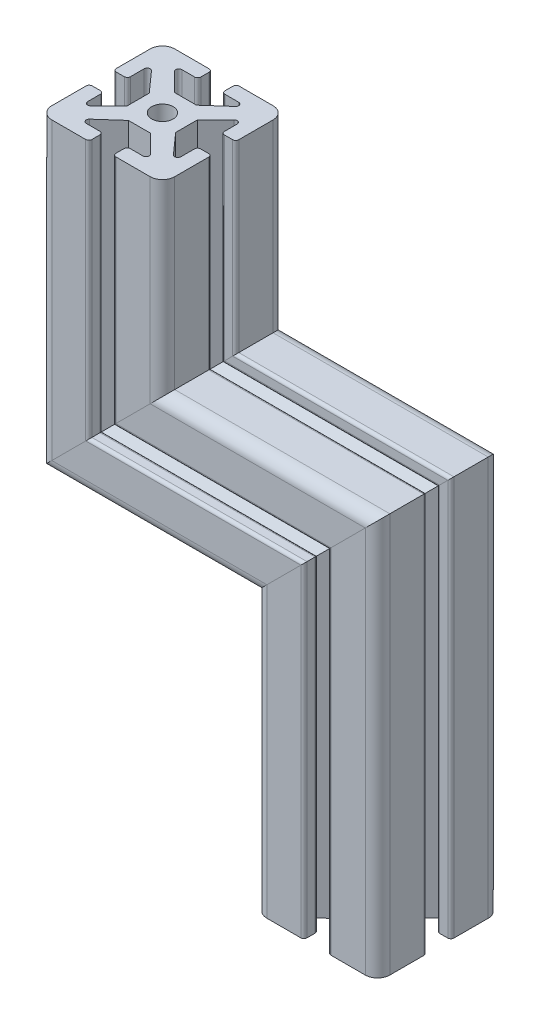
from build123d import *

# Parameters (mm, degrees)
SKETCH1_R                       = 3.492543695
F_001_40_40_EXTRUSION_1_DEPTH   = 109.284271247
SKETCH1_ON_SEGMENT_2_R          = 3.492543695
F_001_40_40_EXTRUSION_1_2_DEPTH = 128.568542495
SKETCH1_ON_SEGMENT_3_R          = 3.492543695
F_001_40_40_EXTRUSION_1_3_DEPTH = 139.284271247


with BuildPart() as part:
    # Sketch1 → 001 40-40_EXTRUSION(1) (new body)
    with BuildSketch(Plane.XZ):
        with BuildLine():
            Line((-0.51168083, 7.684671829), (3.749889801, 7.684671829))
            Line((3.749889801, 7.684671829), (9.699681879, 13.624984685))
            ThreePointArc((9.699681879, 13.624984685), (9.917171057, 14.714970099), (8.993139054, 15.332654972))
            Line((8.993139054, 15.332654972), (4.845630957, 15.332654972))
            ThreePointArc((4.845630957, 15.332654972), (4.138524175, 15.625548191), (3.845630957, 16.332654972))
            Line((3.845630957, 16.332654972), (3.845630957, 19))
            ThreePointArc((3.845630957, 19), (4.138524175, 19.707106781), (4.845630957, 20))
            Line((4.845630957, 20), (16, 20))
            ThreePointArc((16, 20), (18.828427125, 18.828427125), (20, 16))
            Line((20, 16), (20, 4.961087436))
            ThreePointArc((20, 4.961087436), (19.707106781, 4.253980655), (19, 3.961087436))
            Line((19, 3.961087436), (16.388269628, 3.961087436))
            ThreePointArc((16.388269628, 3.961087436), (15.681162846, 4.253980655), (15.388269628, 4.961087436))
            Line((15.388269628, 4.961087436), (15.388269628, 9.408620307))
            ThreePointArc((15.388269628, 9.408620307), (14.744223919, 10.343123673), (13.641676542, 10.073901274))
            Line((13.641676542, 10.073901274), (7.684671829, 3.388818206))
            Line((7.684671829, 3.388818206), (7.684671829, 0.51168083))
            Line((7.684671829, 0.51168083), (7.684671829, -3.749889801))
            Line((7.684671829, -3.749889801), (13.624984685, -9.699681879))
            ThreePointArc((13.624984685, -9.699681879), (14.714970099, -9.917171057), (15.332654972, -8.993139054))
            Line((15.332654972, -8.993139054), (15.332654972, -4.845630957))
            ThreePointArc((15.332654972, -4.845630957), (15.625548191, -4.138524175), (16.332654972, -3.845630957))
            Line((16.332654972, -3.845630957), (19, -3.845630957))
            ThreePointArc((19, -3.845630957), (19.707106781, -4.138524175), (20, -4.845630957))
            Line((20, -4.845630957), (20, -16))
            ThreePointArc((20, -16), (18.828427125, -18.828427125), (16, -20))
            Line((16, -20), (4.961087436, -20))
            ThreePointArc((4.961087436, -20), (4.253980655, -19.707106781), (3.961087436, -19))
            Line((3.961087436, -19), (3.961087436, -16.388269628))
            ThreePointArc((3.961087436, -16.388269628), (4.253980655, -15.681162846), (4.961087436, -15.388269628))
            Line((4.961087436, -15.388269628), (9.408620307, -15.388269628))
            ThreePointArc((9.408620307, -15.388269628), (10.343123673, -14.744223919), (10.073901274, -13.641676542))
            Line((10.073901274, -13.641676542), (3.388818206, -7.684671829))
            Line((3.388818206, -7.684671829), (0.51168083, -7.684671829))
            Line((0.51168083, -7.684671829), (-3.749889801, -7.684671829))
            Line((-3.749889801, -7.684671829), (-9.699681879, -13.624984685))
            ThreePointArc((-9.699681879, -13.624984685), (-9.917171057, -14.714970099), (-8.993139054, -15.332654972))
            Line((-8.993139054, -15.332654972), (-4.845630957, -15.332654972))
            ThreePointArc((-4.845630957, -15.332654972), (-4.138524175, -15.625548191), (-3.845630957, -16.332654972))
            Line((-3.845630957, -16.332654972), (-3.845630957, -19))
            ThreePointArc((-3.845630957, -19), (-4.138524175, -19.707106781), (-4.845630957, -20))
            Line((-4.845630957, -20), (-16, -20))
            ThreePointArc((-16, -20), (-18.828427125, -18.828427125), (-20, -16))
            Line((-20, -16), (-20, -4.961087436))
            ThreePointArc((-20, -4.961087436), (-19.707106781, -4.253980655), (-19, -3.961087436))
            Line((-19, -3.961087436), (-16.388269628, -3.961087436))
            ThreePointArc((-16.388269628, -3.961087436), (-15.681162846, -4.253980655), (-15.388269628, -4.961087436))
            Line((-15.388269628, -4.961087436), (-15.388269628, -9.408620307))
            ThreePointArc((-15.388269628, -9.408620307), (-14.744223919, -10.343123673), (-13.641676542, -10.073901274))
            Line((-13.641676542, -10.073901274), (-7.684671829, -3.388818206))
            Line((-7.684671829, -3.388818206), (-7.684671829, -0.51168083))
            Line((-7.684671829, -0.51168083), (-7.684671829, 3.749889801))
            Line((-7.684671829, 3.749889801), (-13.624984685, 9.699681879))
            ThreePointArc((-13.624984685, 9.699681879), (-14.714970099, 9.917171057), (-15.332654972, 8.993139054))
            Line((-15.332654972, 8.993139054), (-15.332654972, 4.845630957))
            ThreePointArc((-15.332654972, 4.845630957), (-15.625548191, 4.138524175), (-16.332654972, 3.845630957))
            Line((-16.332654972, 3.845630957), (-19, 3.845630957))
            ThreePointArc((-19, 3.845630957), (-19.707106781, 4.138524175), (-20, 4.845630957))
            Line((-20, 4.845630957), (-20, 16))
            ThreePointArc((-20, 16), (-18.828427125, 18.828427125), (-16, 20))
            Line((-16, 20), (-4.961087436, 20))
            ThreePointArc((-4.961087436, 20), (-4.253980655, 19.707106781), (-3.961087436, 19))
            Line((-3.961087436, 19), (-3.961087436, 16.388269628))
            ThreePointArc((-3.961087436, 16.388269628), (-4.253980655, 15.681162846), (-4.961087436, 15.388269628))
            Line((-4.961087436, 15.388269628), (-9.408620307, 15.388269628))
            ThreePointArc((-9.408620307, 15.388269628), (-10.343123673, 14.744223919), (-10.073901274, 13.641676542))
            Line((-10.073901274, 13.641676542), (-3.388818206, 7.684671829))
            Line((-3.388818206, 7.684671829), (-0.51168083, 7.684671829))
        make_face()
        Circle(SKETCH1_R, mode=Mode.SUBTRACT)
    extrude(amount=F_001_40_40_EXTRUSION_1_DEPTH)

    # 001 40-40_EXTRUSION(1) mitre 1
    split(bisect_by=Plane(origin=(0, -80, 0), x_dir=(-0.707106781, -0.707106781, 0), z_dir=(-0.707106781, 0.707106781, 0)), keep=Keep.TOP)


with BuildPart() as body_2:
    # Sketch1 on segment 2 (carried to segment 2) → 001 40-40_EXTRUSION_1 2 (new body)
    with BuildSketch(Plane(origin=(-29.284271247, -80, 0), x_dir=(0, 1, 0), z_dir=(1, 0, 0))):
        with BuildLine():
            Line((-0.51168083, 7.684671829), (3.749889801, 7.684671829))
            Line((3.749889801, 7.684671829), (9.699681879, 13.624984685))
            ThreePointArc((9.699681879, 13.624984685), (9.917171057, 14.714970099), (8.993139054, 15.332654972))
            Line((8.993139054, 15.332654972), (4.845630957, 15.332654972))
            ThreePointArc((4.845630957, 15.332654972), (4.138524175, 15.625548191), (3.845630957, 16.332654972))
            Line((3.845630957, 16.332654972), (3.845630957, 19))
            ThreePointArc((3.845630957, 19), (4.138524175, 19.707106781), (4.845630957, 20))
            Line((4.845630957, 20), (16, 20))
            ThreePointArc((16, 20), (18.828427125, 18.828427125), (20, 16))
            Line((20, 16), (20, 4.961087436))
            ThreePointArc((20, 4.961087436), (19.707106781, 4.253980655), (19, 3.961087436))
            Line((19, 3.961087436), (16.388269628, 3.961087436))
            ThreePointArc((16.388269628, 3.961087436), (15.681162846, 4.253980655), (15.388269628, 4.961087436))
            Line((15.388269628, 4.961087436), (15.388269628, 9.408620307))
            ThreePointArc((15.388269628, 9.408620307), (14.744223919, 10.343123673), (13.641676542, 10.073901274))
            Line((13.641676542, 10.073901274), (7.684671829, 3.388818206))
            Line((7.684671829, 3.388818206), (7.684671829, 0.51168083))
            Line((7.684671829, 0.51168083), (7.684671829, -3.749889801))
            Line((7.684671829, -3.749889801), (13.624984685, -9.699681879))
            ThreePointArc((13.624984685, -9.699681879), (14.714970099, -9.917171057), (15.332654972, -8.993139054))
            Line((15.332654972, -8.993139054), (15.332654972, -4.845630957))
            ThreePointArc((15.332654972, -4.845630957), (15.625548191, -4.138524175), (16.332654972, -3.845630957))
            Line((16.332654972, -3.845630957), (19, -3.845630957))
            ThreePointArc((19, -3.845630957), (19.707106781, -4.138524175), (20, -4.845630957))
            Line((20, -4.845630957), (20, -16))
            ThreePointArc((20, -16), (18.828427125, -18.828427125), (16, -20))
            Line((16, -20), (4.961087436, -20))
            ThreePointArc((4.961087436, -20), (4.253980655, -19.707106781), (3.961087436, -19))
            Line((3.961087436, -19), (3.961087436, -16.388269628))
            ThreePointArc((3.961087436, -16.388269628), (4.253980655, -15.681162846), (4.961087436, -15.388269628))
            Line((4.961087436, -15.388269628), (9.408620307, -15.388269628))
            ThreePointArc((9.408620307, -15.388269628), (10.343123673, -14.744223919), (10.073901274, -13.641676542))
            Line((10.073901274, -13.641676542), (3.388818206, -7.684671829))
            Line((3.388818206, -7.684671829), (0.51168083, -7.684671829))
            Line((0.51168083, -7.684671829), (-3.749889801, -7.684671829))
            Line((-3.749889801, -7.684671829), (-9.699681879, -13.624984685))
            ThreePointArc((-9.699681879, -13.624984685), (-9.917171057, -14.714970099), (-8.993139054, -15.332654972))
            Line((-8.993139054, -15.332654972), (-4.845630957, -15.332654972))
            ThreePointArc((-4.845630957, -15.332654972), (-4.138524175, -15.625548191), (-3.845630957, -16.332654972))
            Line((-3.845630957, -16.332654972), (-3.845630957, -19))
            ThreePointArc((-3.845630957, -19), (-4.138524175, -19.707106781), (-4.845630957, -20))
            Line((-4.845630957, -20), (-16, -20))
            ThreePointArc((-16, -20), (-18.828427125, -18.828427125), (-20, -16))
            Line((-20, -16), (-20, -4.961087436))
            ThreePointArc((-20, -4.961087436), (-19.707106781, -4.253980655), (-19, -3.961087436))
            Line((-19, -3.961087436), (-16.388269628, -3.961087436))
            ThreePointArc((-16.388269628, -3.961087436), (-15.681162846, -4.253980655), (-15.388269628, -4.961087436))
            Line((-15.388269628, -4.961087436), (-15.388269628, -9.408620307))
            ThreePointArc((-15.388269628, -9.408620307), (-14.744223919, -10.343123673), (-13.641676542, -10.073901274))
            Line((-13.641676542, -10.073901274), (-7.684671829, -3.388818206))
            Line((-7.684671829, -3.388818206), (-7.684671829, -0.51168083))
            Line((-7.684671829, -0.51168083), (-7.684671829, 3.749889801))
            Line((-7.684671829, 3.749889801), (-13.624984685, 9.699681879))
            ThreePointArc((-13.624984685, 9.699681879), (-14.714970099, 9.917171057), (-15.332654972, 8.993139054))
            Line((-15.332654972, 8.993139054), (-15.332654972, 4.845630957))
            ThreePointArc((-15.332654972, 4.845630957), (-15.625548191, 4.138524175), (-16.332654972, 3.845630957))
            Line((-16.332654972, 3.845630957), (-19, 3.845630957))
            ThreePointArc((-19, 3.845630957), (-19.707106781, 4.138524175), (-20, 4.845630957))
            Line((-20, 4.845630957), (-20, 16))
            ThreePointArc((-20, 16), (-18.828427125, 18.828427125), (-16, 20))
            Line((-16, 20), (-4.961087436, 20))
            ThreePointArc((-4.961087436, 20), (-4.253980655, 19.707106781), (-3.961087436, 19))
            Line((-3.961087436, 19), (-3.961087436, 16.388269628))
            ThreePointArc((-3.961087436, 16.388269628), (-4.253980655, 15.681162846), (-4.961087436, 15.388269628))
            Line((-4.961087436, 15.388269628), (-9.408620307, 15.388269628))
            ThreePointArc((-9.408620307, 15.388269628), (-10.343123673, 14.744223919), (-10.073901274, 13.641676542))
            Line((-10.073901274, 13.641676542), (-3.388818206, 7.684671829))
            Line((-3.388818206, 7.684671829), (-0.51168083, 7.684671829))
        make_face()
        Circle(SKETCH1_ON_SEGMENT_2_R, mode=Mode.SUBTRACT)
    extrude(amount=F_001_40_40_EXTRUSION_1_2_DEPTH)

    # 001 40-40_EXTRUSION_1 2 mitre 1
    split(bisect_by=Plane(origin=(0, -80, 0), x_dir=(0.707106781, 0.707106781, 0), z_dir=(0.707106781, -0.707106781, 0)), keep=Keep.TOP)

    # 001 40-40_EXTRUSION_1 2 mitre 2
    split(bisect_by=Plane(origin=(70, -80, 0), x_dir=(-0.707106781, -0.707106781, 0), z_dir=(-0.707106781, 0.707106781, 0)), keep=Keep.TOP)


with BuildPart() as body_3:
    # Sketch1 on segment 3 (carried to segment 3) → 001 40-40_EXTRUSION_1 3 (new body)
    with BuildSketch(Plane(origin=(70, -50.715728753, 0), x_dir=(1, 0, 0), z_dir=(0, -1, 0))):
        with BuildLine():
            Line((-0.51168083, 7.684671829), (3.749889801, 7.684671829))
            Line((3.749889801, 7.684671829), (9.699681879, 13.624984685))
            ThreePointArc((9.699681879, 13.624984685), (9.917171057, 14.714970099), (8.993139054, 15.332654972))
            Line((8.993139054, 15.332654972), (4.845630957, 15.332654972))
            ThreePointArc((4.845630957, 15.332654972), (4.138524175, 15.625548191), (3.845630957, 16.332654972))
            Line((3.845630957, 16.332654972), (3.845630957, 19))
            ThreePointArc((3.845630957, 19), (4.138524175, 19.707106781), (4.845630957, 20))
            Line((4.845630957, 20), (16, 20))
            ThreePointArc((16, 20), (18.828427125, 18.828427125), (20, 16))
            Line((20, 16), (20, 4.961087436))
            ThreePointArc((20, 4.961087436), (19.707106781, 4.253980655), (19, 3.961087436))
            Line((19, 3.961087436), (16.388269628, 3.961087436))
            ThreePointArc((16.388269628, 3.961087436), (15.681162846, 4.253980655), (15.388269628, 4.961087436))
            Line((15.388269628, 4.961087436), (15.388269628, 9.408620307))
            ThreePointArc((15.388269628, 9.408620307), (14.744223919, 10.343123673), (13.641676542, 10.073901274))
            Line((13.641676542, 10.073901274), (7.684671829, 3.388818206))
            Line((7.684671829, 3.388818206), (7.684671829, 0.51168083))
            Line((7.684671829, 0.51168083), (7.684671829, -3.749889801))
            Line((7.684671829, -3.749889801), (13.624984685, -9.699681879))
            ThreePointArc((13.624984685, -9.699681879), (14.714970099, -9.917171057), (15.332654972, -8.993139054))
            Line((15.332654972, -8.993139054), (15.332654972, -4.845630957))
            ThreePointArc((15.332654972, -4.845630957), (15.625548191, -4.138524175), (16.332654972, -3.845630957))
            Line((16.332654972, -3.845630957), (19, -3.845630957))
            ThreePointArc((19, -3.845630957), (19.707106781, -4.138524175), (20, -4.845630957))
            Line((20, -4.845630957), (20, -16))
            ThreePointArc((20, -16), (18.828427125, -18.828427125), (16, -20))
            Line((16, -20), (4.961087436, -20))
            ThreePointArc((4.961087436, -20), (4.253980655, -19.707106781), (3.961087436, -19))
            Line((3.961087436, -19), (3.961087436, -16.388269628))
            ThreePointArc((3.961087436, -16.388269628), (4.253980655, -15.681162846), (4.961087436, -15.388269628))
            Line((4.961087436, -15.388269628), (9.408620307, -15.388269628))
            ThreePointArc((9.408620307, -15.388269628), (10.343123673, -14.744223919), (10.073901274, -13.641676542))
            Line((10.073901274, -13.641676542), (3.388818206, -7.684671829))
            Line((3.388818206, -7.684671829), (0.51168083, -7.684671829))
            Line((0.51168083, -7.684671829), (-3.749889801, -7.684671829))
            Line((-3.749889801, -7.684671829), (-9.699681879, -13.624984685))
            ThreePointArc((-9.699681879, -13.624984685), (-9.917171057, -14.714970099), (-8.993139054, -15.332654972))
            Line((-8.993139054, -15.332654972), (-4.845630957, -15.332654972))
            ThreePointArc((-4.845630957, -15.332654972), (-4.138524175, -15.625548191), (-3.845630957, -16.332654972))
            Line((-3.845630957, -16.332654972), (-3.845630957, -19))
            ThreePointArc((-3.845630957, -19), (-4.138524175, -19.707106781), (-4.845630957, -20))
            Line((-4.845630957, -20), (-16, -20))
            ThreePointArc((-16, -20), (-18.828427125, -18.828427125), (-20, -16))
            Line((-20, -16), (-20, -4.961087436))
            ThreePointArc((-20, -4.961087436), (-19.707106781, -4.253980655), (-19, -3.961087436))
            Line((-19, -3.961087436), (-16.388269628, -3.961087436))
            ThreePointArc((-16.388269628, -3.961087436), (-15.681162846, -4.253980655), (-15.388269628, -4.961087436))
            Line((-15.388269628, -4.961087436), (-15.388269628, -9.408620307))
            ThreePointArc((-15.388269628, -9.408620307), (-14.744223919, -10.343123673), (-13.641676542, -10.073901274))
            Line((-13.641676542, -10.073901274), (-7.684671829, -3.388818206))
            Line((-7.684671829, -3.388818206), (-7.684671829, -0.51168083))
            Line((-7.684671829, -0.51168083), (-7.684671829, 3.749889801))
            Line((-7.684671829, 3.749889801), (-13.624984685, 9.699681879))
            ThreePointArc((-13.624984685, 9.699681879), (-14.714970099, 9.917171057), (-15.332654972, 8.993139054))
            Line((-15.332654972, 8.993139054), (-15.332654972, 4.845630957))
            ThreePointArc((-15.332654972, 4.845630957), (-15.625548191, 4.138524175), (-16.332654972, 3.845630957))
            Line((-16.332654972, 3.845630957), (-19, 3.845630957))
            ThreePointArc((-19, 3.845630957), (-19.707106781, 4.138524175), (-20, 4.845630957))
            Line((-20, 4.845630957), (-20, 16))
            ThreePointArc((-20, 16), (-18.828427125, 18.828427125), (-16, 20))
            Line((-16, 20), (-4.961087436, 20))
            ThreePointArc((-4.961087436, 20), (-4.253980655, 19.707106781), (-3.961087436, 19))
            Line((-3.961087436, 19), (-3.961087436, 16.388269628))
            ThreePointArc((-3.961087436, 16.388269628), (-4.253980655, 15.681162846), (-4.961087436, 15.388269628))
            Line((-4.961087436, 15.388269628), (-9.408620307, 15.388269628))
            ThreePointArc((-9.408620307, 15.388269628), (-10.343123673, 14.744223919), (-10.073901274, 13.641676542))
            Line((-10.073901274, 13.641676542), (-3.388818206, 7.684671829))
            Line((-3.388818206, 7.684671829), (-0.51168083, 7.684671829))
        make_face()
        Circle(SKETCH1_ON_SEGMENT_3_R, mode=Mode.SUBTRACT)
    extrude(amount=F_001_40_40_EXTRUSION_1_3_DEPTH)

    # 001 40-40_EXTRUSION_1 3 mitre 1
    split(bisect_by=Plane(origin=(70, -80, 0), x_dir=(0.707106781, 0.707106781, 0), z_dir=(0.707106781, -0.707106781, 0)), keep=Keep.TOP)


solid = Compound([part.part, body_2.part, body_3.part])
